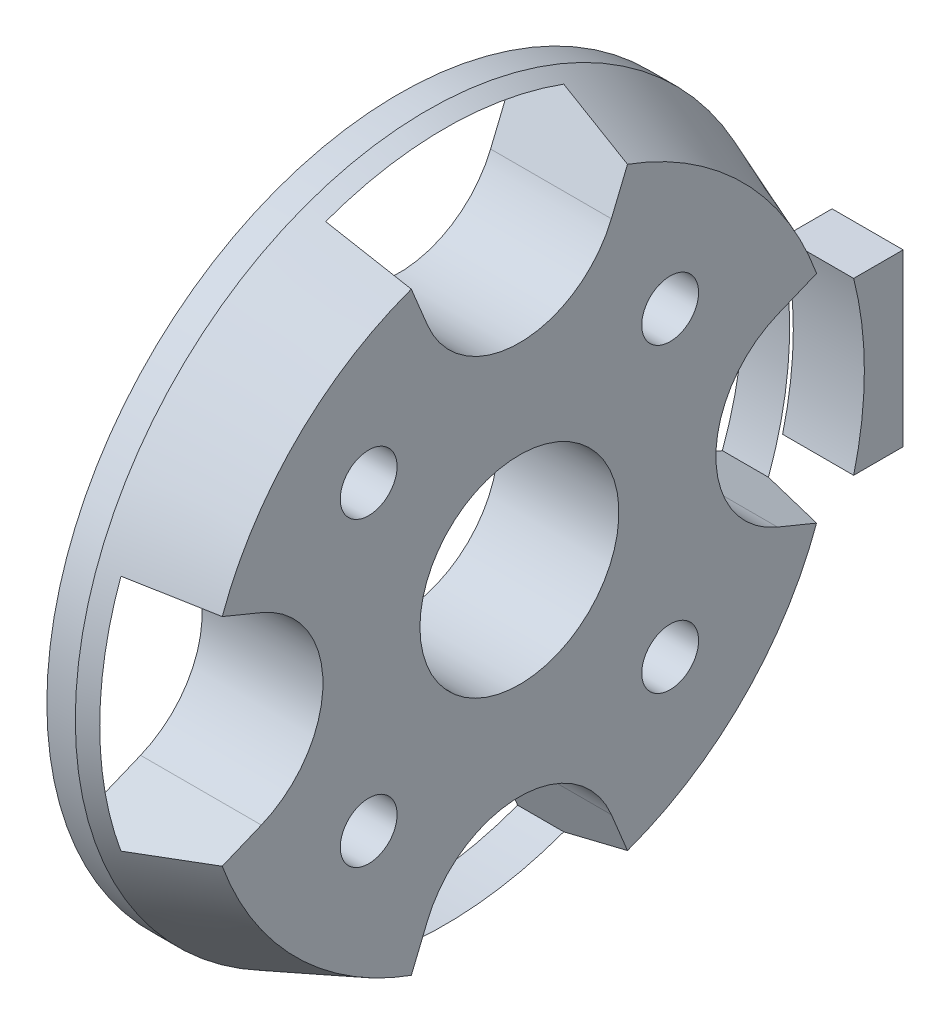
from build123d import *

# Parameters (mm, degrees)
SKETCH3_R           = 2
CUT_EXTRUDE1_DEPTH  = 5
SKETCH4_W           = 12
SKETCH4_H           = 12
BOSS_EXTRUDE1_DEPTH = 5
CUT_EXTRUDE2_DEPTH  = 38.600698132
CIRPATTERN1_COUNT   = 4


with BuildPart() as part:
    # Sketch2 → Revolve1 (revolve)
    with BuildSketch(Plane.XY, mode=Mode.PRIVATE) as revolve1_sk:
        Polygon((0, 24.75), (2, 24.75), (8.5, 22.25), (8.5, 7), (0, 7), align=None)
    revolve(revolve1_sk.sketch.rotate(Axis((0, 0, 0), (1, 0, 0)), 90), axis=Axis((0, 0, 0), (1, 0, 0)))

    # Sketch3 → Cut-Extrude1 (cut)
    with BuildSketch(Plane(origin=(8.5, 0, 0), x_dir=(0, 0, -1), z_dir=(1, 0, 0))):
        with Locations((10.606601718, 10.606601718)):
            Circle(SKETCH3_R)
        with Locations((10.606601718, -10.606601718)):
            Circle(SKETCH3_R)
        with Locations((-10.606601718, -10.606601718)):
            Circle(SKETCH3_R)
        with Locations((-10.606601718, 10.606601718)):
            Circle(SKETCH3_R)
    extrude(amount=-CUT_EXTRUDE1_DEPTH, mode=Mode.SUBTRACT)

    # Sketch4 → Boss-Extrude1 (add)
    with BuildSketch(Plane(origin=(8.5, 0, 0), x_dir=(0, 0, -1), z_dir=(1, 0, 0))):
        with Locations((21, 0)):
            Rectangle(SKETCH4_W, SKETCH4_H)
    extrude(amount=-BOSS_EXTRUDE1_DEPTH)

    # Sketch6 → Cut-Extrude2 (cut, through all)
    with BuildSketch(Plane(origin=(8.5, 0, 0), x_dir=(0, 0, -1), z_dir=(1, 0, 0))):
        with BuildLine():
            Line((-6.472300805, 18.157581623), (-7.606019278, 20.909590401))
            Line((-7.606019278, 20.909590401), (-8.376823121, 22.780653627))
            ThreePointArc((-8.376823121, 22.780653627), (0, 24.271986842), (8.376823121, 22.780653627))
            Line((8.376823121, 22.780653627), (7.606019278, 20.909590401))
            Line((7.606019278, 20.909590401), (6.472300805, 18.157581623))
            ThreePointArc((6.472300805, 18.157581623), (0, 13.823912866), (-6.472300805, 18.157581623))
        make_face()
    cut_extrude2 = extrude(amount=-CUT_EXTRUDE2_DEPTH, mode=Mode.SUBTRACT)

    # CirPattern1: Cut-Extrude2 ×4 about axis
    cirpattern1_axis = Axis((0, 0, 0), (1, 0, 0))
    for i in range(1, CIRPATTERN1_COUNT):
        add(cut_extrude2.rotate(cirpattern1_axis, i * 360 / CIRPATTERN1_COUNT), mode=Mode.SUBTRACT)


solid = part.part
